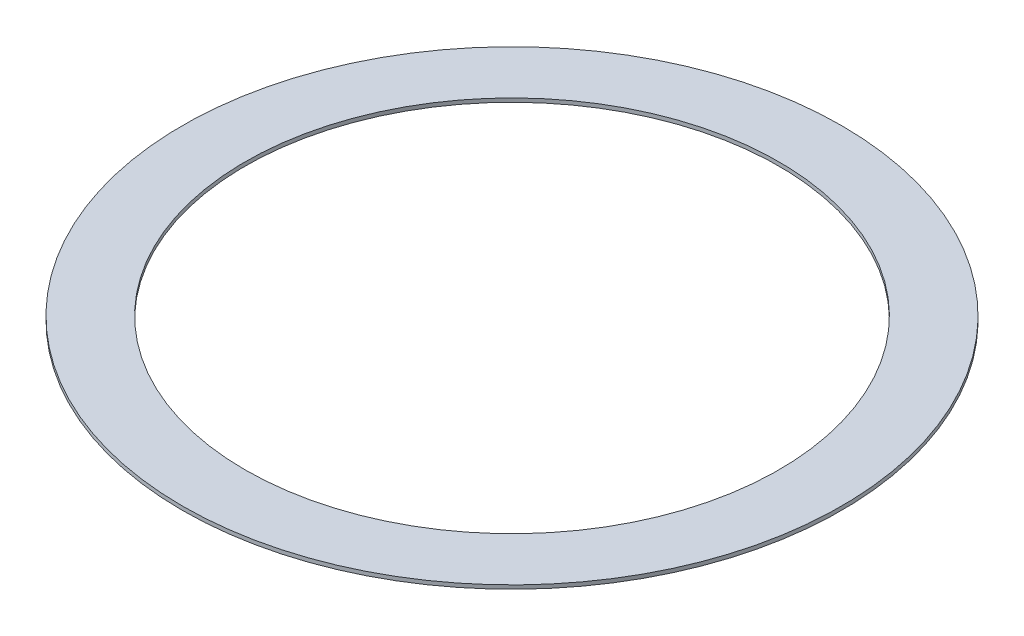
from build123d import *

# Parameters (mm, degrees)
SKETCH1_R           = 435
SKETCH1_R_2         = 352.26
BOSS_EXTRUDE1_DEPTH = 5


with BuildPart() as part:
    # Sketch1 → Boss-Extrude1 (new body)
    with BuildSketch(Plane(origin=(0, 0, 0), x_dir=(1, 0, 0), z_dir=(0, 1, 0))):
        with Locations(Location((0, 0, 0), (0, 0, 270))):
            Circle(SKETCH1_R)
        with Locations(Location((0, 0, 0), (0, 0, 270))):
            Circle(SKETCH1_R_2, mode=Mode.SUBTRACT)
    extrude(amount=BOSS_EXTRUDE1_DEPTH)


solid = part.part
